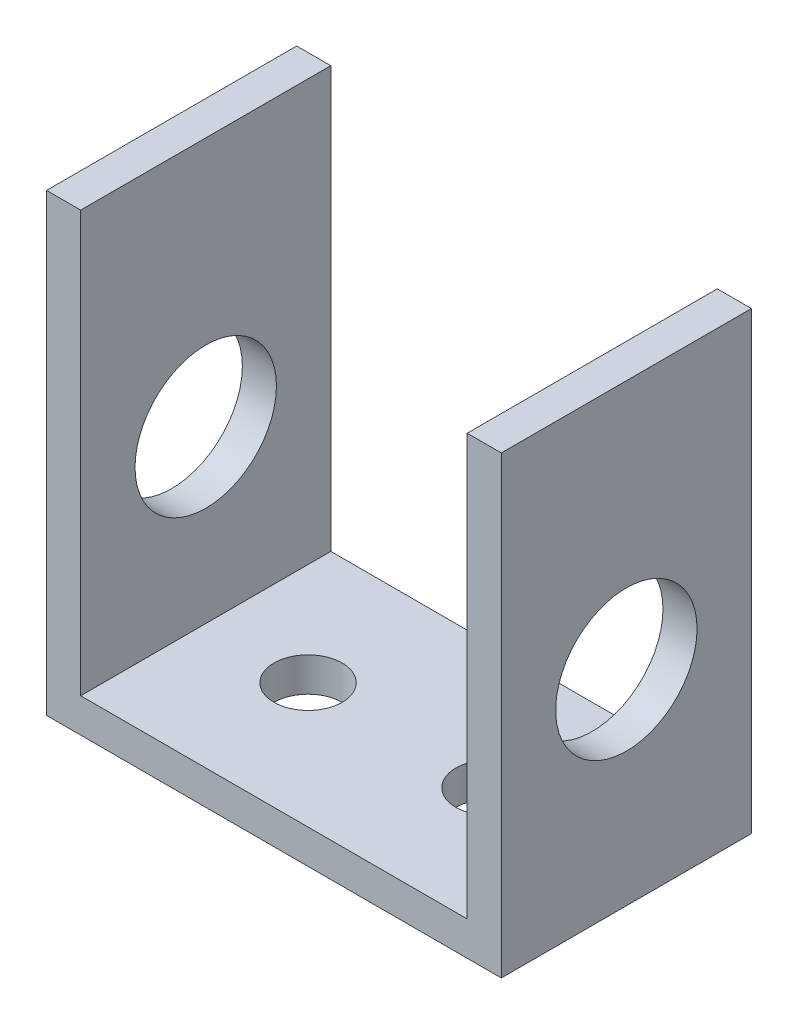
from build123d import *

# Parameters (mm, degrees)
EXTRUSION1_DEPTH = 11
ESQUISSE2_R      = 3.11
EXTRUSION2_DEPTH = 27.424530578
ESQUISSE3_R      = 1.5
EXTRUSION3_DEPTH = 11


with BuildPart() as part:
    # Esquisse1 → Extrusion1 (new body)
    with BuildSketch(Plane.XY):
        Polygon((-11.094787824, -6.686254611), (-11.094787824, 13.313745389), (-9.594787824, 13.313745389), (-9.594787824, -5.186254611), (7.405212176, -5.186254611), (7.405212176, 13.313745389), (8.905212176, 13.313745389), (8.905212176, -6.686254611), align=None)
    extrude(amount=EXTRUSION1_DEPTH)

    # Esquisse2 → Extrusion2 (cut, through all)
    with BuildSketch(Plane(origin=(8.905212176, 0, 0), x_dir=(0, 0, -1), z_dir=(1, 0, 0))):
        with Locations((-5.5, 2.313745389)):
            Circle(ESQUISSE2_R)
    extrude(amount=-EXTRUSION2_DEPTH, mode=Mode.SUBTRACT)

    # Esquisse3 → Extrusion3 (cut)
    with BuildSketch(Plane(origin=(0, -5.186254611, 0), x_dir=(-1, 0, 0), z_dir=(0, 1, 0))):
        with Locations(Location((5.094787824, 5.5, 0), (0, 0, 90))):
            Circle(ESQUISSE3_R)
        with Locations(Location((-2.905212176, 5.5, 0), (0, 0, 90))):
            Circle(ESQUISSE3_R)
    extrude(amount=-EXTRUSION3_DEPTH, mode=Mode.SUBTRACT)


solid = part.part
